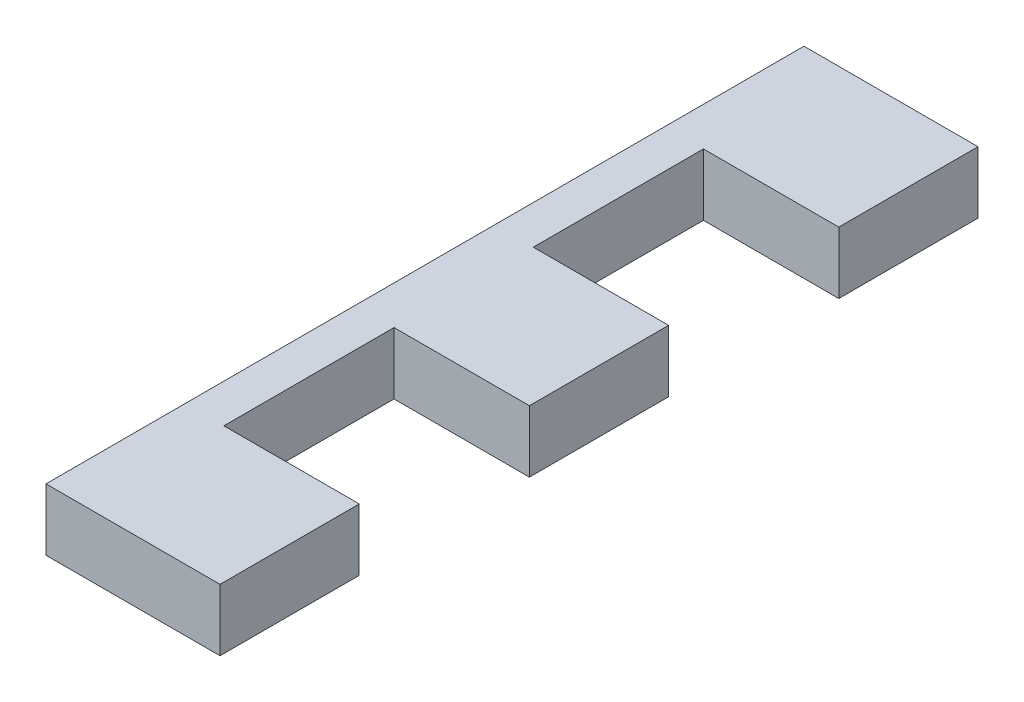
from build123d import *

# Parameters (mm, degrees)
SKETCH_1_W      = 1.8
SKETCH_1_H      = 0.8
EXTRUDE_1_DEPTH = 3.5
SKETCH_2_W      = 19.6
SKETCH_2_H      = 1.6
EXTRUDE_2_DEPTH = 1


with BuildPart() as part:
    # 草图1 → 凸台-拉伸1 (new body)
    with BuildSketch(Plane(origin=(0, 0, 0), x_dir=(0, 0, -1), z_dir=(1, 0, 0))):
        Polygon((-8, -0.8), (-8, 0), (-8, 0.8), (-9.8, 0.8), (-9.8, -0.8), align=None)
        with Locations((-7.1, -0.4)):
            Rectangle(SKETCH_1_W, SKETCH_1_H)
        with Locations((-7.1, 0.4)):
            Rectangle(SKETCH_1_W, SKETCH_1_H)
        with Locations((-0.9, 0.4)):
            Rectangle(SKETCH_1_W, SKETCH_1_H)
        with Locations((-0.9, -0.4)):
            Rectangle(SKETCH_1_W, SKETCH_1_H)
        with Locations((0.9, -0.4)):
            Rectangle(SKETCH_1_W, SKETCH_1_H)
        with Locations((0.9, 0.4)):
            Rectangle(SKETCH_1_W, SKETCH_1_H)
        with Locations((7.1, -0.4)):
            Rectangle(SKETCH_1_W, SKETCH_1_H)
        with Locations((7.1, 0.4)):
            Rectangle(SKETCH_1_W, SKETCH_1_H)
        Polygon((8, 0.8), (8, 0), (8, -0.8), (9.8, -0.8), (9.8, 0.8), align=None)
    extrude(amount=EXTRUDE_1_DEPTH)

    # 草图2 → 凸台-拉伸2 (add)
    with BuildSketch(Plane.ZY):
        Rectangle(SKETCH_2_W, SKETCH_2_H)
    extrude(amount=EXTRUDE_2_DEPTH)


solid = part.part
